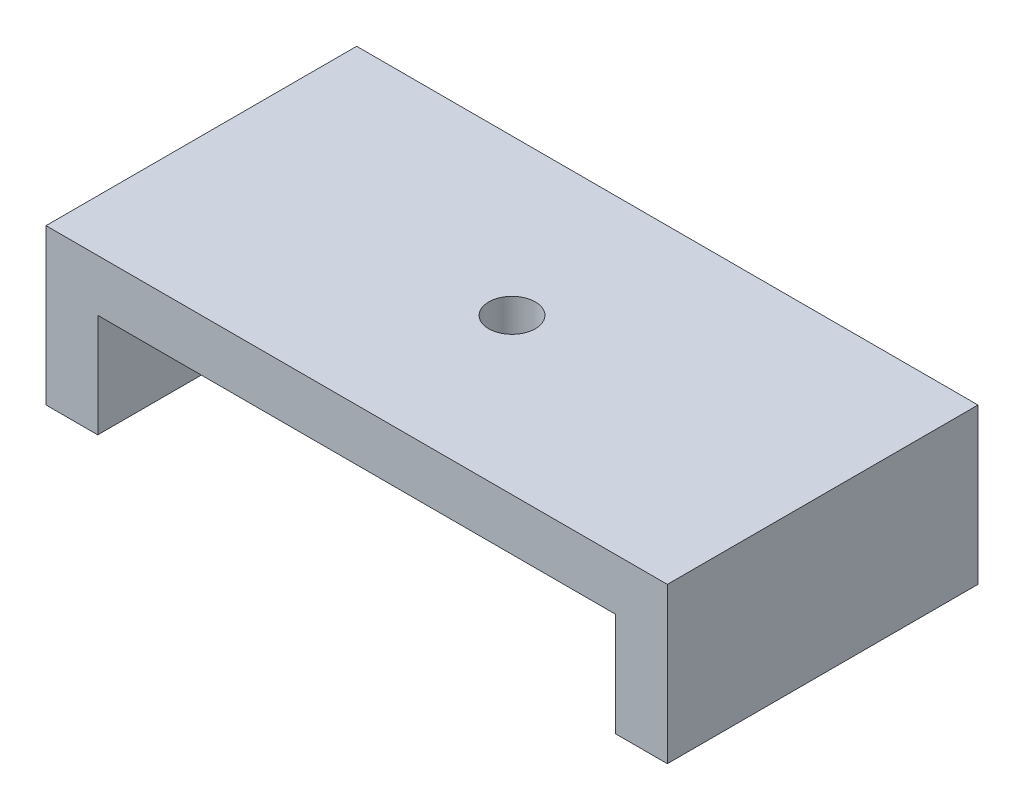
from build123d import *

# Parameters (mm, degrees)
BOSS_EXTRUDE1_DEPTH = 30
SKETCH2_R           = 2.25
CUT_EXTRUDE1_DEPTH  = 69.738635424


with BuildPart() as part:
    # Sketch1 → Boss-Extrude1 (new body)
    with BuildSketch(Plane.XY):
        Polygon((0, 0), (60, 0), (60, -15), (55, -15), (55, -5), (5, -5), (5, -15), (0, -15), align=None)
    extrude(amount=BOSS_EXTRUDE1_DEPTH)

    # Sketch2 → Cut-Extrude1 (cut, through all)
    with BuildSketch(Plane(origin=(0, 0, 0), x_dir=(1, 0, 0), z_dir=(0, 1, 0))):
        with Locations(Location((30, -15, 0), (0, 0, 270))):
            Circle(SKETCH2_R)
    extrude(amount=-CUT_EXTRUDE1_DEPTH, mode=Mode.SUBTRACT)


solid = part.part
